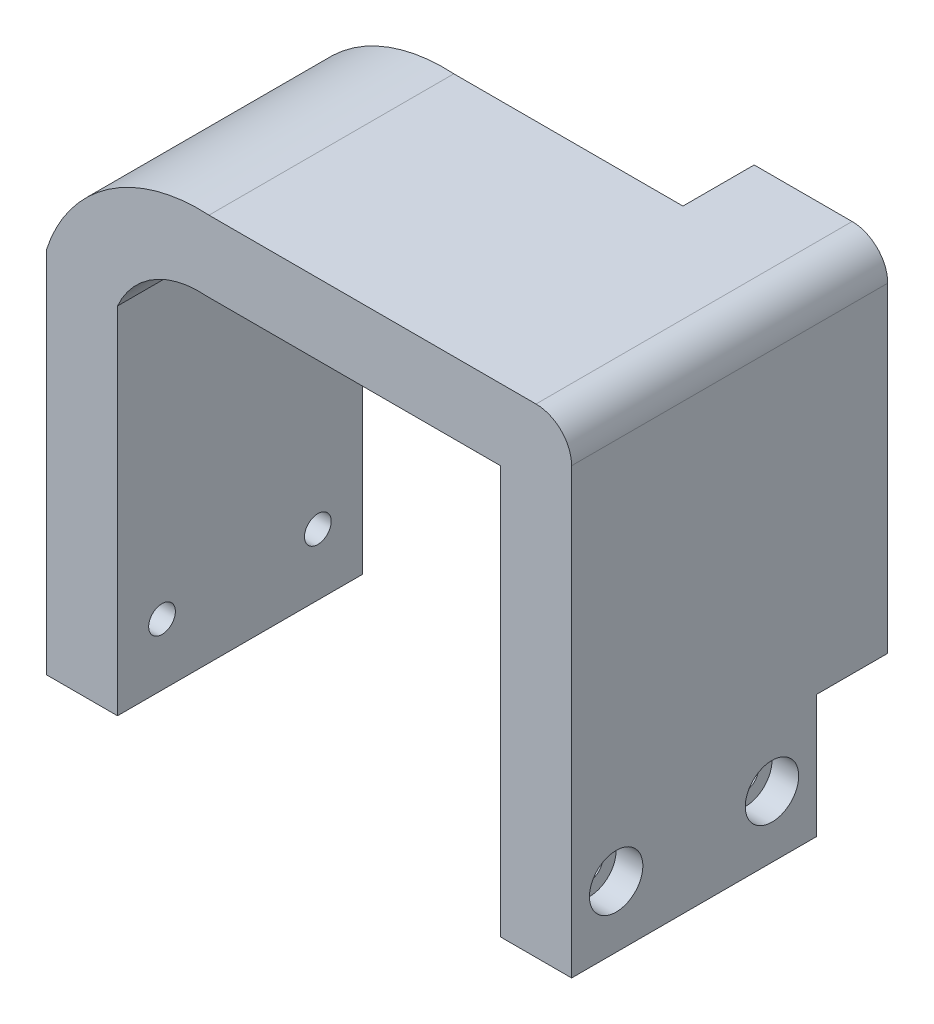
from build123d import *

# Parameters (mm, degrees)
BOSS_EXTRUDE1_DEPTH = 27.5
SKETCH3_W           = 15
SKETCH3_H           = 40
BOSS_EXTRUDE2_DEPTH = 8
SKETCH4_R           = 1.25
CUT_EXTRUDE1_DEPTH  = 70.371250359
CUT_EXTRUDE2_START  = -6
SKETCH4_3_R         = 2
SKETCH4_3_R_2       = 1.25
CUT_EXTRUDE2_DEPTH  = 2
SKETCH5_R           = 1.5
CUT_EXTRUDE3_DEPTH  = 84.963392862
SKETCH5_3_R         = 3
SKETCH5_3_R_2       = 1.5
CUT_EXTRUDE4_DEPTH  = 3
FILLET1_R           = 4


with BuildPart() as part:
    # Sketch1 → Boss-Extrude1 (new body)
    with BuildSketch(Plane.XY):
        with BuildLine():
            Line((-27.263565268, -0.826290167), (-27.263565268, 39.032085652))
            ThreePointArc((-27.263565268, 39.032085652), (-23.226265639, 43.618644017), (-17.274109595, 45))
            Line((-17.274109595, 45), (15.736434732, 45))
            Line((15.736434732, 45), (15.736434732, -0.826290167))
            Line((15.736434732, -0.826290167), (23.736434732, -0.826290167))
            Line((23.736434732, -0.826290167), (23.736434732, 53))
            Line((23.736434732, 53), (-16.992356062, 53))
            ThreePointArc((-16.992356062, 53), (-28.288998955, 49.870920305), (-35.263565268, 40.449630311))
            Line((-35.263565268, 40.449630311), (-35.263565268, -0.826290167))
            Line((-35.263565268, -0.826290167), (-27.263565268, -0.826290167))
        make_face()
    extrude(amount=BOSS_EXTRUDE1_DEPTH)

    # Sketch3 → Boss-Extrude2 (add)
    with BuildSketch(Plane(origin=(0, 0, 0), x_dir=(-1, 0, 0), z_dir=(0, 0, -1))):
        with Locations((-16.236434732, 33)):
            Rectangle(SKETCH3_W, SKETCH3_H)
    extrude(amount=BOSS_EXTRUDE2_DEPTH)

    # Sketch4 → Cut-Extrude1 (cut, through all)
    with BuildSketch(Plane.XY):
        with Locations((12.736434732, 42.5)):
            Circle(SKETCH4_R)
        with Locations((12.736434732, 15.5)):
            Circle(SKETCH4_R)
    extrude(amount=-CUT_EXTRUDE1_DEPTH, mode=Mode.SUBTRACT)

    # Sketch4<3> → Cut-Extrude2 (cut)
    # profile 1 of 2: a face of its own
    with BuildSketch(Plane.XY.offset(CUT_EXTRUDE2_START)):
        with Locations(Location((12.736434732, 42.5, 0), (0, 0, 180))):
            Circle(SKETCH4_3_R)
        with Locations((12.736434732, 42.5)):
            Circle(SKETCH4_3_R_2, mode=Mode.SUBTRACT)
    # profile 2 of 2: a face of its own
    with BuildSketch(Plane.XY.offset(CUT_EXTRUDE2_START)):
        with Locations(Location((12.736434732, 15.5, 0), (0, 0, 180))):
            Circle(SKETCH4_3_R)
        with Locations((12.736434732, 15.5)):
            Circle(SKETCH4_3_R_2, mode=Mode.SUBTRACT)
    extrude(amount=-CUT_EXTRUDE2_DEPTH, mode=Mode.SUBTRACT)

    # Sketch5 → Cut-Extrude3 (cut, through all)
    with BuildSketch(Plane(origin=(23.736434732, 0, 0), x_dir=(0, 0, -1), z_dir=(1, 0, 0))):
        with Locations((-22.5, 6.086854916)):
            Circle(SKETCH5_R)
        with Locations((-5, 6.086854916)):
            Circle(SKETCH5_R)
    extrude(amount=-CUT_EXTRUDE3_DEPTH, mode=Mode.SUBTRACT)

    # Sketch5<3> → Cut-Extrude4 (cut)
    # profile 1 of 2: a face of its own
    with BuildSketch(Plane(origin=(23.736434732, 0, 0), x_dir=(0, 0, -1), z_dir=(1, 0, 0))):
        with Locations((-22.5, 6.086854916)):
            Circle(SKETCH5_3_R)
        with Locations((-22.5, 6.086854916)):
            Circle(SKETCH5_3_R_2, mode=Mode.SUBTRACT)
    # profile 2 of 2: a face of its own
    with BuildSketch(Plane(origin=(23.736434732, 0, 0), x_dir=(0, 0, -1), z_dir=(1, 0, 0))):
        with Locations((-5, 6.086854916)):
            Circle(SKETCH5_3_R)
        with Locations((-5, 6.086854916)):
            Circle(SKETCH5_3_R_2, mode=Mode.SUBTRACT)
    cut_extrude4 = extrude(amount=-CUT_EXTRUDE4_DEPTH, mode=Mode.SUBTRACT)

    # Mirror1: Cut-Extrude4 across plane
    add(cut_extrude4.mirror(Plane(origin=(-5.763565268, 0, 0), x_dir=(0, 0, 1), z_dir=(1, 0, 0))), mode=Mode.SUBTRACT)

    # Fillet1
    fillet1_edges = [part.edges().sort_by_distance(p)[0] for p in [
        (23.736434732, 53, 9.75),
    ]]
    fillet(fillet1_edges, radius=FILLET1_R)


solid = part.part
